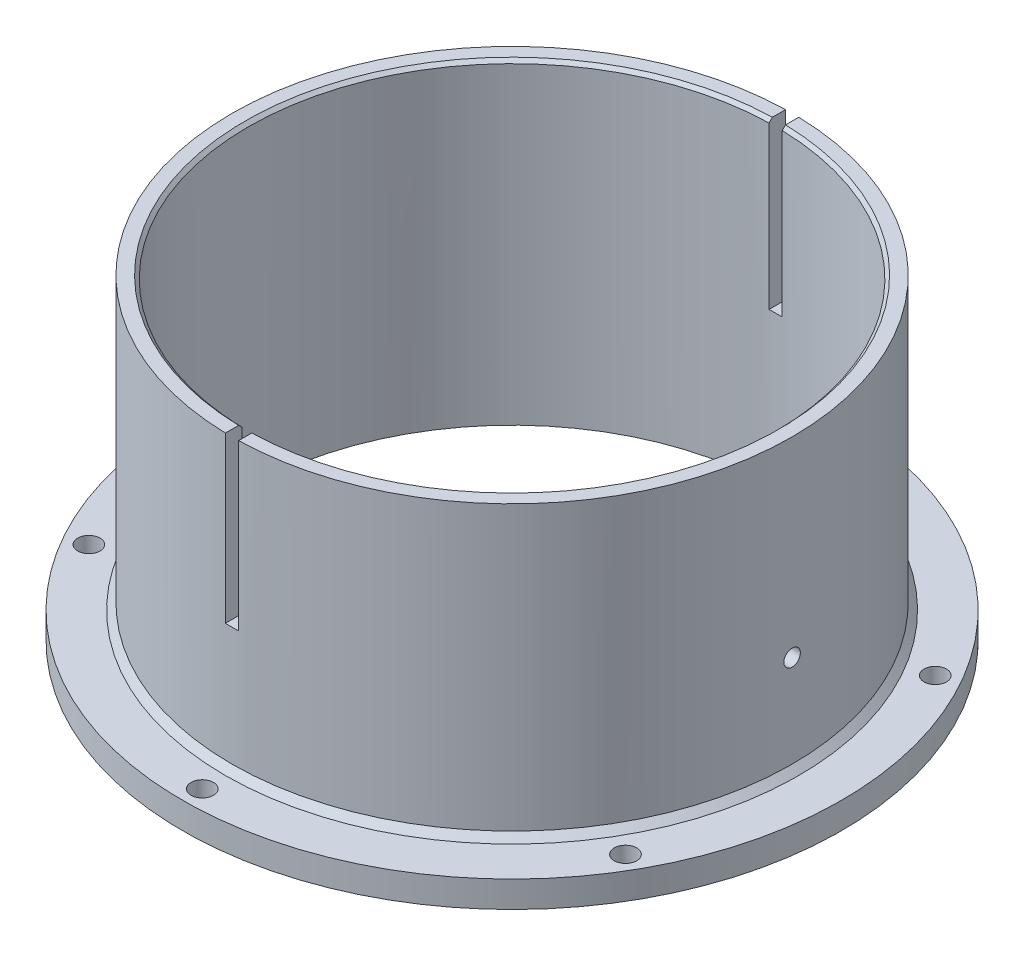
from build123d import *

# Parameters (mm, degrees)
CHAMFER_1_SIZE            = 1
CHAMFER_2_SIZE            = 0.5
SKETCH_2_W                = 2
SKETCH_2_H                = 25
CUT_EXTRUDE_694_DEPTH     = 50
HOLE_WIZARD_M3_1_D        = 3.4
HOLE_WIZARD_M3_1_2_REACH  = 111.075
HOLE_WIZARD_M3_1_2_BORE_R = 1.25


with BuildPart() as part:
    # 草图1 → 旋转1 (revolve)
    with BuildSketch(Plane.XY, mode=Mode.PRIVATE) as revolve_1_sk:
        Polygon((40, 0), (50, 0), (50, 4), (42.5, 4), (42.5, 48), (40, 48), align=None)
    revolve(revolve_1_sk.sketch.rotate(Axis((0, 0, 0), (0, 1, 0)), 90), axis=Axis((0, 0, 0), (0, 1, 0)))

    # 倒角1
    chamfer_1_edges = [part.edges().sort_by_distance(p)[0] for p in [
        (0, 4, 42.5),
    ]]
    chamfer(chamfer_1_edges, length=CHAMFER_1_SIZE)

    # 倒角2
    chamfer_2_edges = [part.edges().sort_by_distance(p)[0] for p in [
        (0, 48, 40),
    ]]
    chamfer(chamfer_2_edges, length=CHAMFER_2_SIZE)

    # 草图2 → Cut-Extrude 694 (cut, symmetric)
    with BuildSketch(Plane.XY):
        with Locations((0, 35.5)):
            Rectangle(SKETCH_2_W, SKETCH_2_H)
    extrude(amount=CUT_EXTRUDE_694_DEPTH, both=True, mode=Mode.SUBTRACT)

    # Hole Wizard M3 _1 (through all)
    with Locations(Plane(origin=(0, 0, 0), x_dir=(-1, 0, 0), z_dir=(0, -1, 0))):
        with Locations((0, 47), (40.703193978, 23.5), (40.703193978, -23.5), (0, -47), (-40.703193978, -23.5), (-40.703193978, 23.5)):
            Hole(HOLE_WIZARD_M3_1_D / 2)

    # Hole Wizard M3 _1 2 bore (on position points) → Hole Wizard M3 _1 2 (cut, up to next)
    with BuildSketch(Plane(origin=(42.5, 19, 0), x_dir=(0, 0, 1), z_dir=(1, 0, 0)), mode=Mode.PRIVATE) as hole_wizard_m3_1_2_sk1:
        Circle(HOLE_WIZARD_M3_1_2_BORE_R)
    hole_wizard_m3_1_2_tool1 = extrude(hole_wizard_m3_1_2_sk1.sketch, amount=-HOLE_WIZARD_M3_1_2_REACH, mode=Mode.PRIVATE) & part.part
    add(hole_wizard_m3_1_2_tool1.solids().sort_by_distance((42.5, 19, 0))[0], mode=Mode.SUBTRACT)


solid = part.part
